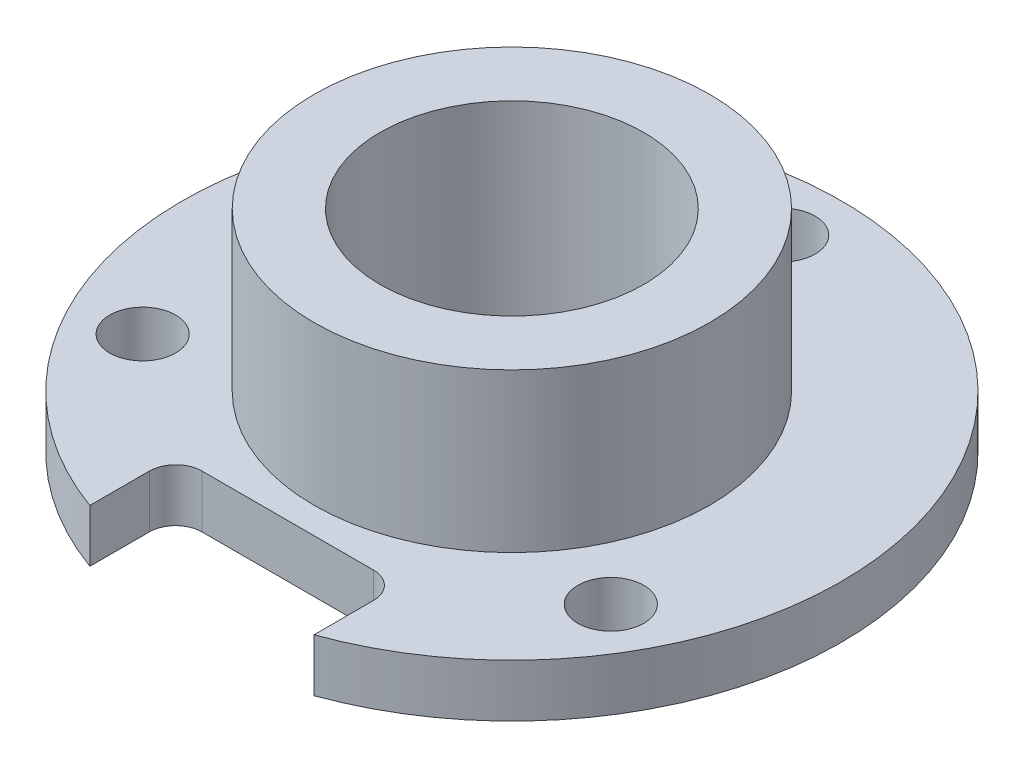
from build123d import *

# Parameters (mm, degrees)
SKETCH1_R           = 12.5
SKETCH1_R_2         = 7.5
BOSS_EXTRUDE1_DEPTH = 2
SKETCH1_3_R         = 7.5
SKETCH1_3_R_2       = 5
BOSS_EXTRUDE2_DEPTH = 8
CUT_EXTRUDE1_DEPTH  = 2
SKETCH3_R           = 1.25
CUT_EXTRUDE2_DEPTH  = 2


with BuildPart() as part:
    # Sketch1 → Boss-Extrude1 (new body)
    with BuildSketch(Plane(origin=(0, 0, 0), x_dir=(1, 0, 0), z_dir=(0, 1, 0))):
        with Locations(Location((0, 0, 0), (0, 0, 270))):
            Circle(SKETCH1_R)
        with Locations(Location((0, 0, 0), (0, 0, 270))):
            Circle(SKETCH1_R_2, mode=Mode.SUBTRACT)
    extrude(amount=BOSS_EXTRUDE1_DEPTH)

    # Sketch1<3> → Boss-Extrude2 (add)
    with BuildSketch(Plane(origin=(0, 0, 0), x_dir=(1, 0, 0), z_dir=(0, 1, 0))):
        with Locations(Location((0, 0, 0), (0, 0, 270))):
            Circle(SKETCH1_3_R)
        with Locations(Location((0, 0, 0), (0, 0, 270))):
            Circle(SKETCH1_3_R_2, mode=Mode.SUBTRACT)
    extrude(amount=BOSS_EXTRUDE2_DEPTH)

    # Sketch2 → Cut-Extrude1 (cut)
    with BuildSketch(Plane(origin=(0, 2, 0), x_dir=(1, 0, 0), z_dir=(0, 1, 0))):
        with BuildLine():
            Line((-4.25, -13.5), (4.25, -13.5))
            Line((4.25, -13.5), (4.25, -9.5))
            ThreePointArc((4.25, -9.5), (3.957106781, -8.792893219), (3.25, -8.5))
            Line((3.25, -8.5), (-3.25, -8.5))
            ThreePointArc((-3.25, -8.5), (-3.957106781, -8.792893219), (-4.25, -9.5))
            Line((-4.25, -9.5), (-4.25, -13.5))
        make_face()
    extrude(amount=-CUT_EXTRUDE1_DEPTH, mode=Mode.SUBTRACT)

    # Sketch3 → Cut-Extrude2 (cut)
    with BuildSketch(Plane(origin=(0, 2, 0), x_dir=(1, 0, 0), z_dir=(0, 1, 0))):
        with Locations(Location((0, 10.25, 0), (0, 0, 270))):
            Circle(SKETCH3_R)
        with Locations(Location((8.876760389, -5.125, 0), (0, 0, 270))):
            Circle(SKETCH3_R)
        with Locations(Location((-8.876760389, -5.125, 0), (0, 0, 270))):
            Circle(SKETCH3_R)
    extrude(amount=-CUT_EXTRUDE2_DEPTH, mode=Mode.SUBTRACT)


solid = part.part
